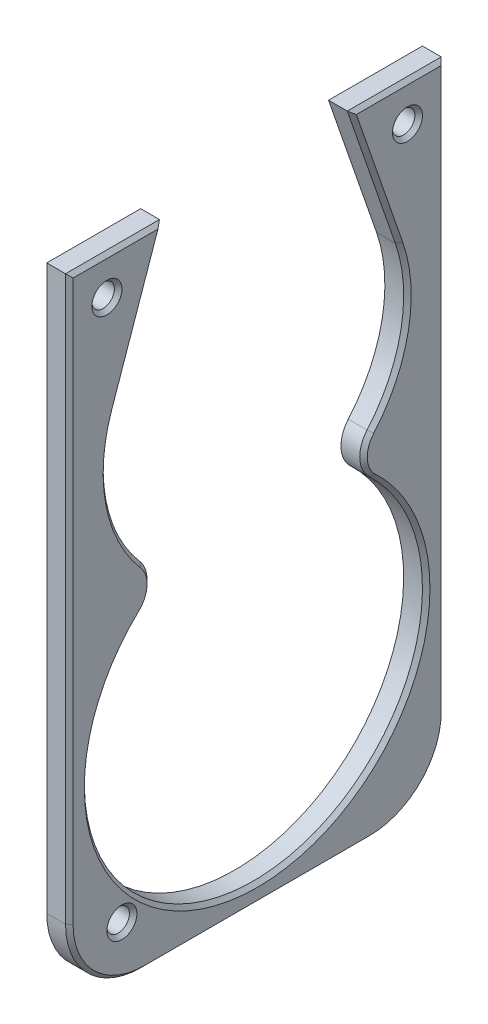
from build123d import *

# Parameters (mm, degrees)
SKETCH_1_W          = 50
SKETCH_1_H          = 85
EXTRUDE_1_DEPTH     = 3
FILLET_2_R          = 10
SKETCH_4_R          = 1.5
CUT_EXTRUDE_1_DEPTH = 3
CHAMFER_1_SIZE      = 0.5
CUT_EXTRUDE_3_DEPTH = 3
SKETCH_7_R          = 22.5
CUT_EXTRUDE_4_DEPTH = 3
FILLET_4_R          = 4
CHAMFER_2_SIZE      = 0.5
CHAMFER_3_SIZE      = 0.5


with BuildPart() as part:
    # 草图1 → 凸台-拉伸1 (new body)
    with BuildSketch(Plane(origin=(0, 0, 0), x_dir=(0, 0, -1), z_dir=(1, 0, 0))):
        with Locations((0, 7.5)):
            Rectangle(SKETCH_1_W, SKETCH_1_H)
    extrude(amount=EXTRUDE_1_DEPTH)

    # 圆角2
    fillet_2_edges = [part.edges().sort_by_distance(p)[0] for p in [
        (1.5, -35, -25),
        (1.5, -35, 25),
    ]]
    fillet(fillet_2_edges, radius=FILLET_2_R)

    # 草图4 → 切除-拉伸1 (cut)
    with BuildSketch(Plane(origin=(3, 0, 0), x_dir=(0, 0, -1), z_dir=(1, 0, 0))):
        with Locations((20, 45)):
            Circle(SKETCH_4_R)
        with Locations((-20, 45)):
            Circle(SKETCH_4_R)
        with Locations((-18, -28)):
            Circle(SKETCH_4_R)
    extrude(amount=-CUT_EXTRUDE_1_DEPTH, mode=Mode.SUBTRACT)

    # 倒角1
    chamfer_1_edges = [part.edges().sort_by_distance(p)[0] for p in [
        (3, 12.5, -25),
        (3, 50, 0),
        (3, -35, 0),
        (3, -32.071067812, 22.071067812),
        (3, -32.071067812, -22.071067812),
        (3, 12.5, 25),
    ]]
    chamfer(chamfer_1_edges, length=CHAMFER_1_SIZE)

    # 草图6 → 切除-拉伸3 (cut)
    with BuildSketch(Plane(origin=(3, 0, 0), x_dir=(0, 0, -1), z_dir=(1, 0, 0))):
        with BuildLine():
            Line((-12.5, 50), (12.5, 50))
            Line((12.5, 50), (18.896399481, 31.551800259))
            ThreePointArc((18.896399481, 31.551800259), (0, 5), (-18.896399481, 31.551800259))
            Line((-18.896399481, 31.551800259), (-12.5, 50))
        make_face()
    extrude(amount=-CUT_EXTRUDE_3_DEPTH, mode=Mode.SUBTRACT)

    # 草图7 → 切除-拉伸4 (cut)
    with BuildSketch(Plane(origin=(3, 0, 0), x_dir=(0, 0, -1), z_dir=(1, 0, 0))):
        with Locations((0, -10)):
            Circle(SKETCH_7_R)
    extrude(amount=-CUT_EXTRUDE_4_DEPTH, mode=Mode.SUBTRACT)

    # 圆角4
    fillet_4_edges = [part.edges().sort_by_distance(p)[0] for p in [
        (1.5, 9.017857143, 12.02377269),
        (1.5, 9.017857143, -12.02377269),
    ]]
    fillet(fillet_4_edges, radius=FILLET_4_R)

    # 倒角2
    chamfer_2_edges = [part.edges().sort_by_distance(p)[0] for p in [
        (3, 45, -18.5),
        (3, 45, 21.5),
        (3, -28, 19.5),
    ]]
    chamfer(chamfer_2_edges, length=CHAMFER_2_SIZE)

    # 倒角3
    chamfer_3_edges = [part.edges().sort_by_distance(p)[0] for p in [
        (3, 40.52590013, -15.784880278),
        (3, 21.231347471, -19.641722382),
        (3, 9.097355452, -14.160817784),
        (3, -32.5, 0),
        (3, 40.52590013, 15.784880278),
        (3, 9.097355452, 14.160817784),
        (3, 21.231347471, 19.641722382),
    ]]
    chamfer(chamfer_3_edges, length=CHAMFER_3_SIZE)


solid = part.part
